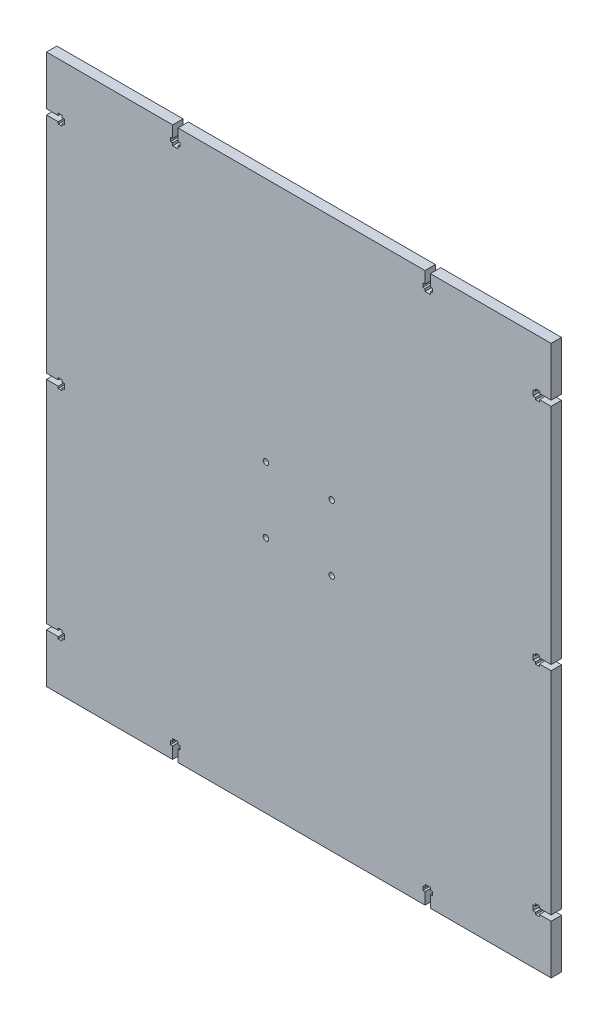
from build123d import *

# Parameters (mm, degrees)
SKETCH_1_R      = 1.6
EXTRUDE_1_DEPTH = 6


with BuildPart() as part:
    # Эскиз1 → Бобышка-Вытянуть1 (new body)
    with BuildSketch(Plane.XY):
        Polygon((-142.627592608, 165.17616196), (-69.627592608, 165.17616196), (-69.627592608, 158.37616196), (-70.827592608, 158.37616196), (-70.827592608, 156.17616196), (-69.627592608, 156.17616196), (-69.627592608, 154.67616196), (-66.527592608, 154.67616196), (-66.527592608, 156.17616196), (-65.327592608, 156.17616196), (-65.327592608, 158.37616196), (-66.527592608, 158.37616196), (-66.527592608, 165.17616196), (76.372407392, 165.17616196), (76.372407392, 158.37616196), (75.172407392, 158.37616196), (75.172407392, 156.17616196), (76.372407392, 156.17616196), (76.372407392, 154.67616196), (79.472407392, 154.67616196), (79.472407392, 156.17616196), (80.672407392, 156.17616196), (80.672407392, 158.37616196), (79.472407392, 158.37616196), (79.472407392, 165.17616196), (149.372407392, 165.17616196), (149.372407392, 136.72616196), (142.572407392, 136.72616196), (142.572407392, 137.92616196), (140.372407392, 137.92616196), (140.372407392, 136.72616196), (138.872407392, 136.72616196), (138.872407392, 133.62616196), (140.372407392, 133.62616196), (140.372407392, 132.42616196), (142.572407392, 132.42616196), (142.572407392, 133.62616196), (149.372407392, 133.62616196), (149.372407392, 132.07616196), (149.372407392, 4.22616196), (142.572407392, 4.22616196), (142.572407392, 5.42616196), (140.372407392, 5.42616196), (140.372407392, 4.22616196), (138.872407392, 4.22616196), (138.872407392, 1.12616196), (140.372407392, 1.12616196), (140.372407392, -0.07383804), (142.572407392, -0.07383804), (142.572407392, 1.12616196), (149.372407392, 1.12616196), (149.372407392, -121.27383804), (142.572407392, -121.27383804), (142.572407392, -120.07383804), (140.372407392, -120.07383804), (140.372407392, -121.27383804), (138.872407392, -121.27383804), (138.872407392, -124.37383804), (140.372407392, -124.37383804), (140.372407392, -125.57383804), (142.572407392, -125.57383804), (142.572407392, -124.37383804), (149.372407392, -124.37383804), (149.372407392, -152.82383804), (79.472407392, -152.82383804), (79.472407392, -146.02383804), (80.672407392, -146.02383804), (80.672407392, -143.82383804), (79.472407392, -143.82383804), (79.472407392, -142.32383804), (76.372407392, -142.32383804), (76.372407392, -143.82383804), (75.172407392, -143.82383804), (75.172407392, -146.02383804), (76.372407392, -146.02383804), (76.372407392, -152.82383804), (-66.527592608, -152.82383804), (-66.527592608, -146.02383804), (-65.327592608, -146.02383804), (-65.327592608, -143.82383804), (-66.527592608, -143.82383804), (-66.527592608, -142.32383804), (-69.627592608, -142.32383804), (-69.627592608, -143.82383804), (-70.827592608, -143.82383804), (-70.827592608, -146.02383804), (-69.627592608, -146.02383804), (-69.627592608, -152.82383804), (-142.627592608, -152.82383804), (-142.627592608, -124.37383804), (-135.827592608, -124.37383804), (-135.827592608, -125.57383804), (-133.627592608, -125.57383804), (-133.627592608, -124.37383804), (-132.127592608, -124.37383804), (-132.127592608, -121.27383804), (-133.627592608, -121.27383804), (-133.627592608, -120.07383804), (-135.827592608, -120.07383804), (-135.827592608, -121.27383804), (-142.627592608, -121.27383804), (-142.627592608, 1.12616196), (-135.827592608, 1.12616196), (-135.827592608, -0.07383804), (-133.627592608, -0.07383804), (-133.627592608, 1.12616196), (-132.127592608, 1.12616196), (-132.127592608, 4.22616196), (-133.627592608, 4.22616196), (-133.627592608, 5.42616196), (-135.827592608, 5.42616196), (-135.827592608, 4.22616196), (-142.627592608, 4.22616196), (-142.627592608, 133.62616196), (-135.827592608, 133.62616196), (-135.827592608, 132.42616196), (-133.627592608, 132.42616196), (-133.627592608, 133.62616196), (-132.127592608, 133.62616196), (-132.127592608, 136.72616196), (-133.627592608, 136.72616196), (-133.627592608, 137.92616196), (-135.827592608, 137.92616196), (-135.827592608, 136.72616196), (-142.627592608, 136.72616196), align=None)
        with Locations((22.372407392, 23.22616196)):
            Circle(SKETCH_1_R, mode=Mode.SUBTRACT)
        with Locations(Location((-15.627592608, 23.22616196, 0), (0, 0, 180))):
            Circle(SKETCH_1_R, mode=Mode.SUBTRACT)
        with Locations(Location((22.372407392, -14.77383804, 0), (0, 0, 180))):
            Circle(SKETCH_1_R, mode=Mode.SUBTRACT)
        with Locations((-15.627592608, -14.77383804)):
            Circle(SKETCH_1_R, mode=Mode.SUBTRACT)
    extrude(amount=EXTRUDE_1_DEPTH)


solid = part.part
